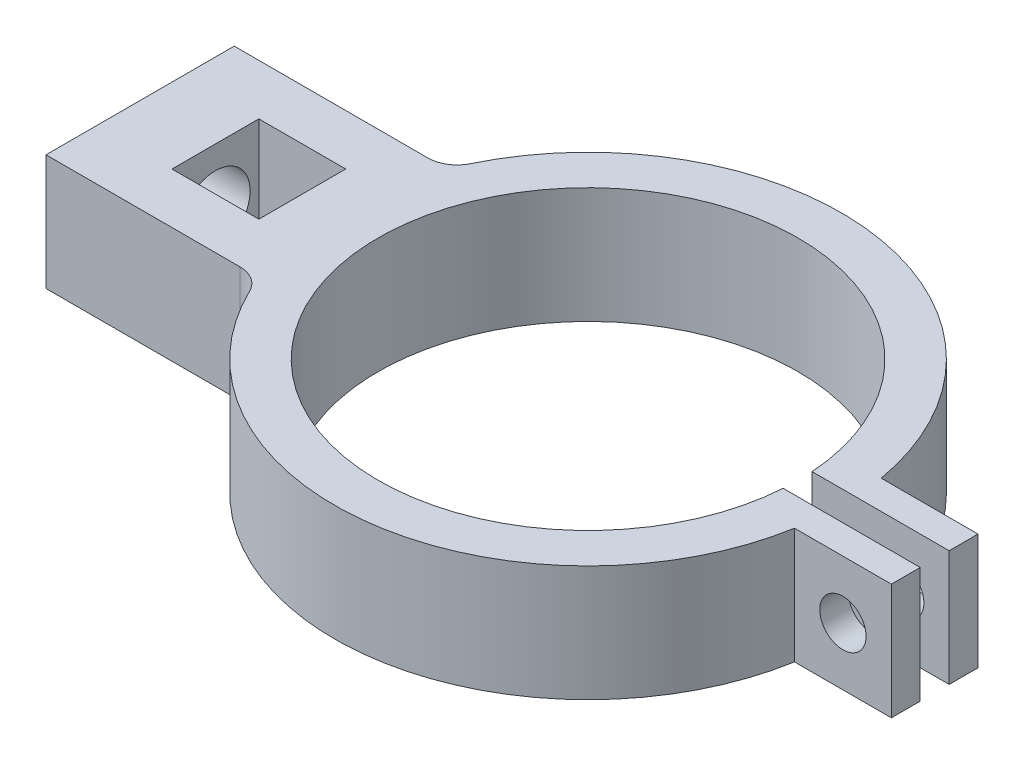
from build123d import *

# Parameters (mm, degrees)
SKETCH1_W           = 7.62
SKETCH1_H           = 7.62
BOSS_EXTRUDE3_DEPTH = 10.16
CUT_EXTRUDE1_REACH  = 50.217
SKETCH5_R           = 2.032
SKETCH6_R           = 3.048
CUT_EXTRUDE2_DEPTH  = 6.604
FILLET1_R           = 2.54


with BuildPart() as part:
    # Sketch1 → Boss-Extrude3 (new body)
    with BuildSketch(Plane(origin=(0, 0, 0), x_dir=(1, 0, 0), z_dir=(0, 1, 0))):
        with BuildLine():
            Line((30.391199938, 3.809632415), (30.39361467, 1.278687681))
            Line((30.39361467, 1.278687681), (18.370552055, 1.278687681))
            ThreePointArc((18.370552055, 1.278687681), (-18.414997941, -0.008709001), (18.371753296, -1.261311151))
            Line((18.371753296, -1.261311151), (30.394815911, -1.261311151))
            Line((30.394815911, -1.261311151), (30.394215941, -3.792256965))
            Line((30.394215941, -3.792256965), (21.899073316, -3.792256965))
            ThreePointArc((21.899073316, -3.792256965), (2.319149157, -22.103668749), (-20.635057548, -8.255))
            Line((-20.635057548, -8.255), (-39.292036048, -8.255))
            Line((-39.292036048, -8.255), (-39.292036048, 8.255))
            Line((-39.292036048, 8.255), (-20.635057548, 8.255))
            ThreePointArc((-20.635057548, 8.255), (2.310379481, 22.104587118), (21.896057313, 3.809632415))
            Line((21.896057313, 3.809632415), (30.391199938, 3.809632415))
        make_face()
        with Locations((-28.878036048, -0.000367585)):
            Rectangle(SKETCH1_W, SKETCH1_H, mode=Mode.SUBTRACT)
    extrude(amount=BOSS_EXTRUDE3_DEPTH)

    # Cut-Extrude1: up to this face of the body (flat: up to its plane)
    cut_extrude1_end = Plane(part.part.faces().sort_by_distance((26.146644628, 5.08, 3.792256965))[0])
    # Sketch5 → Cut-Extrude1 (cut, up to the picked face)
    with BuildSketch(Plane(origin=(0, 0, -3.809632415), x_dir=(-1, 0, 0), z_dir=(0, 0, -1)), mode=Mode.PRIVATE) as cut_extrude1_sk1:
        with Locations((-26.145136627, 5.08)):
            Circle(SKETCH5_R)
    cut_extrude1_tool1 = split(extrude(cut_extrude1_sk1.sketch, amount=-CUT_EXTRUDE1_REACH, mode=Mode.PRIVATE), bisect_by=cut_extrude1_end, keep=Keep.BOTH, mode=Mode.PRIVATE)
    add(cut_extrude1_tool1.solids().sort_by(Axis((26.145137, 5.08, -3.809632), (0, 0, 1)))[0], mode=Mode.SUBTRACT)

    # Sketch6 → Cut-Extrude2 (cut)
    with BuildSketch(Plane.ZY.offset(39.292036048)):
        with Locations((0, 5.08)):
            Circle(SKETCH6_R)
    extrude(amount=-CUT_EXTRUDE2_DEPTH, mode=Mode.SUBTRACT)

    # Fillet1
    fillet1_edges = [part.edges().sort_by_distance(p)[0] for p in [
        (-20.635057548, 5.08, 8.255),
        (-20.635057548, 5.08, -8.255),
    ]]
    fillet(fillet1_edges, radius=FILLET1_R)


solid = part.part
